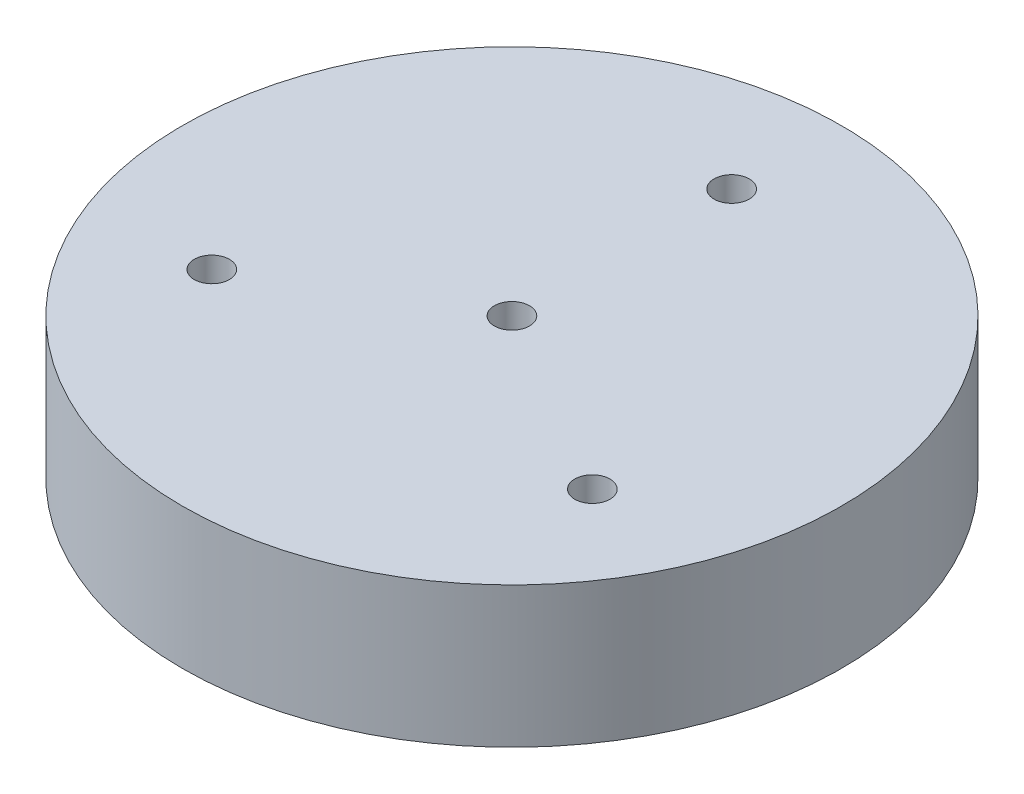
from build123d import *

# Parameters (mm, degrees)
SKETCH1_R           = 75
BOSS_EXTRUDE1_DEPTH = 32
SKETCH2_R           = 4
CUT_EXTRUDE1_DEPTH  = 111.788086002
CIRPATTERN1_COUNT   = 3
SKETCH3_R           = 4
CUT_EXTRUDE2_DEPTH  = 111.788086002


with BuildPart() as part:
    # Sketch1 → Boss-Extrude1 (new body)
    with BuildSketch(Plane(origin=(0, 0, 0), x_dir=(1, 0, 0), z_dir=(0, 1, 0))):
        Circle(SKETCH1_R)
    extrude(amount=BOSS_EXTRUDE1_DEPTH)

    # Sketch2 → Cut-Extrude1 (cut, through all)
    with BuildSketch(Plane(origin=(0, 32, 0), x_dir=(1, 0, 0), z_dir=(0, 1, 0))):
        with Locations((0, 50)):
            Circle(SKETCH2_R)
    cut_extrude1 = extrude(amount=-CUT_EXTRUDE1_DEPTH, mode=Mode.SUBTRACT)

    # CirPattern1: Cut-Extrude1 ×3 about axis
    cirpattern1_axis = Axis((0, 33.6, 0), (0, -1, 0))
    for i in range(1, CIRPATTERN1_COUNT):
        add(cut_extrude1.rotate(cirpattern1_axis, i * 360 / CIRPATTERN1_COUNT), mode=Mode.SUBTRACT)

    # Sketch3 → Cut-Extrude2 (cut, through all)
    with BuildSketch(Plane(origin=(0, 32, 0), x_dir=(1, 0, 0), z_dir=(0, 1, 0))):
        Circle(SKETCH3_R)
    extrude(amount=-CUT_EXTRUDE2_DEPTH, mode=Mode.SUBTRACT)


solid = part.part
